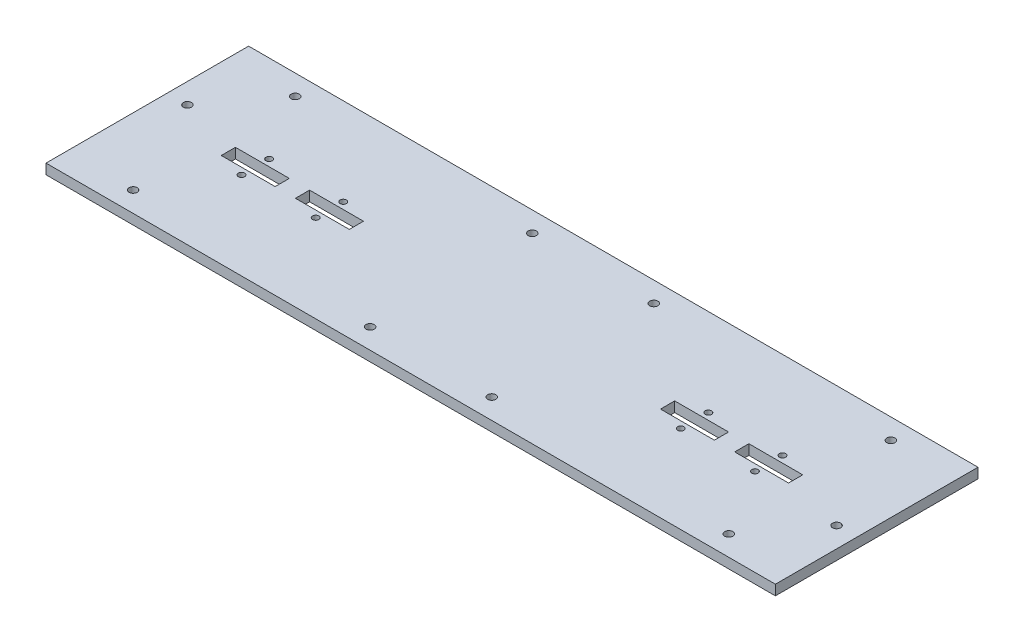
from build123d import *

# Parameters (mm, degrees)
SKETCH1_W           = 457.2
SKETCH1_H           = 127
SKETCH1_R           = 2.5527
BOSS_EXTRUDE1_DEPTH = 6.35
CUT_EXTRUDE1_REACH  = 476.554
SKETCH2_R           = 1.9812
SKETCH2_W           = 33.782
SKETCH2_H           = 8.89


with BuildPart() as part:
    # Sketch1 → Boss-Extrude1 (new body)
    with BuildSketch(Plane(origin=(0, 0, 0), x_dir=(1, 0, 0), z_dir=(0, 1, 0))):
        with Locations((228.6, 63.5)):
            Rectangle(SKETCH1_W, SKETCH1_H)
        with Locations(Location((41.91, 114.3, 0), (0, 0, 270))):
            Circle(SKETCH1_R, mode=Mode.SUBTRACT)
        with Locations(Location((415.29, 114.3, 0), (0, 0, 270))):
            Circle(SKETCH1_R, mode=Mode.SUBTRACT)
        with Locations(Location((415.29, 12.7, 0), (0, 0, 270))):
            Circle(SKETCH1_R, mode=Mode.SUBTRACT)
        with Locations(Location((41.91, 12.7, 0), (0, 0, 270))):
            Circle(SKETCH1_R, mode=Mode.SUBTRACT)
        with Locations(Location((190.5, 114.3, 0), (0, 0, 270))):
            Circle(SKETCH1_R, mode=Mode.SUBTRACT)
        with Locations(Location((266.7, 114.3, 0), (0, 0, 270))):
            Circle(SKETCH1_R, mode=Mode.SUBTRACT)
        with Locations(Location((190.5, 12.7, 0), (0, 0, 270))):
            Circle(SKETCH1_R, mode=Mode.SUBTRACT)
        with Locations(Location((266.7, 12.7, 0), (0, 0, 270))):
            Circle(SKETCH1_R, mode=Mode.SUBTRACT)
        with Locations(Location((444.5, 51.054, 0), (0, 0, 270))):
            Circle(SKETCH1_R, mode=Mode.SUBTRACT)
        with Locations(Location((12.7, 75.946, 0), (0, 0, 270))):
            Circle(SKETCH1_R, mode=Mode.SUBTRACT)
    extrude(amount=BOSS_EXTRUDE1_DEPTH)

    # Sketch2 → Cut-Extrude1 (cut, up to next)
    with BuildSketch(Plane(origin=(0, 0, 0), x_dir=(-1, 0, 0), z_dir=(0, -1, 0)), mode=Mode.PRIVATE) as cut_extrude1_sk1:
        with Locations(Location((-389.509, 54.864, 0), (0, 0, 90))):
            Circle(SKETCH2_R)
    cut_extrude1_tool1 = extrude(cut_extrude1_sk1.sketch, amount=-CUT_EXTRUDE1_REACH, mode=Mode.PRIVATE) & part.part
    # Sketch2 → Cut-Extrude1 (cut, up to next)
    with BuildSketch(Plane(origin=(0, 0, 0), x_dir=(-1, 0, 0), z_dir=(0, -1, 0)), mode=Mode.PRIVATE) as cut_extrude1_sk2:
        with Locations(Location((-389.509, 72.136, 0), (0, 0, 90))):
            Circle(SKETCH2_R)
    cut_extrude1_tool2 = extrude(cut_extrude1_sk2.sketch, amount=-CUT_EXTRUDE1_REACH, mode=Mode.PRIVATE) & part.part
    # Sketch2 → Cut-Extrude1 (cut, up to next)
    with BuildSketch(Plane(origin=(0, 0, 0), x_dir=(-1, 0, 0), z_dir=(0, -1, 0)), mode=Mode.PRIVATE) as cut_extrude1_sk3:
        with Locations(Location((-343.027, 54.864, 0), (0, 0, 90))):
            Circle(SKETCH2_R)
    cut_extrude1_tool3 = extrude(cut_extrude1_sk3.sketch, amount=-CUT_EXTRUDE1_REACH, mode=Mode.PRIVATE) & part.part
    # Sketch2 → Cut-Extrude1 (cut, up to next)
    with BuildSketch(Plane(origin=(0, 0, 0), x_dir=(-1, 0, 0), z_dir=(0, -1, 0)), mode=Mode.PRIVATE) as cut_extrude1_sk4:
        with Locations(Location((-343.027, 72.136, 0), (0, 0, 90))):
            Circle(SKETCH2_R)
    cut_extrude1_tool4 = extrude(cut_extrude1_sk4.sketch, amount=-CUT_EXTRUDE1_REACH, mode=Mode.PRIVATE) & part.part
    # Sketch2 → Cut-Extrude1 (cut, up to next)
    with BuildSketch(Plane(origin=(0, 0, 0), x_dir=(-1, 0, 0), z_dir=(0, -1, 0)), mode=Mode.PRIVATE) as cut_extrude1_sk5:
        with Locations(Location((-114.173, 54.864, 0), (0, 0, 90))):
            Circle(SKETCH2_R)
    cut_extrude1_tool5 = extrude(cut_extrude1_sk5.sketch, amount=-CUT_EXTRUDE1_REACH, mode=Mode.PRIVATE) & part.part
    # Sketch2 → Cut-Extrude1 (cut, up to next)
    with BuildSketch(Plane(origin=(0, 0, 0), x_dir=(-1, 0, 0), z_dir=(0, -1, 0)), mode=Mode.PRIVATE) as cut_extrude1_sk6:
        with Locations(Location((-114.173, 72.136, 0), (0, 0, 90))):
            Circle(SKETCH2_R)
    cut_extrude1_tool6 = extrude(cut_extrude1_sk6.sketch, amount=-CUT_EXTRUDE1_REACH, mode=Mode.PRIVATE) & part.part
    # Sketch2 → Cut-Extrude1 (cut, up to next)
    with BuildSketch(Plane(origin=(0, 0, 0), x_dir=(-1, 0, 0), z_dir=(0, -1, 0)), mode=Mode.PRIVATE) as cut_extrude1_sk7:
        with Locations(Location((-67.691, 54.864, 0), (0, 0, 90))):
            Circle(SKETCH2_R)
    cut_extrude1_tool7 = extrude(cut_extrude1_sk7.sketch, amount=-CUT_EXTRUDE1_REACH, mode=Mode.PRIVATE) & part.part
    # Sketch2 → Cut-Extrude1 (cut, up to next)
    with BuildSketch(Plane(origin=(0, 0, 0), x_dir=(-1, 0, 0), z_dir=(0, -1, 0)), mode=Mode.PRIVATE) as cut_extrude1_sk8:
        with Locations(Location((-67.691, 72.136, 0), (0, 0, 90))):
            Circle(SKETCH2_R)
    cut_extrude1_tool8 = extrude(cut_extrude1_sk8.sketch, amount=-CUT_EXTRUDE1_REACH, mode=Mode.PRIVATE) & part.part
    # Sketch2 → Cut-Extrude1 (cut, up to next)
    with BuildSketch(Plane(origin=(0, 0, 0), x_dir=(-1, 0, 0), z_dir=(0, -1, 0)), mode=Mode.PRIVATE) as cut_extrude1_sk9:
        with Locations((-114.173, 63.5)):
            Rectangle(SKETCH2_W, SKETCH2_H)
    cut_extrude1_tool9 = extrude(cut_extrude1_sk9.sketch, amount=-CUT_EXTRUDE1_REACH, mode=Mode.PRIVATE) & part.part
    # Sketch2 → Cut-Extrude1 (cut, up to next)
    with BuildSketch(Plane(origin=(0, 0, 0), x_dir=(-1, 0, 0), z_dir=(0, -1, 0)), mode=Mode.PRIVATE) as cut_extrude1_sk10:
        with Locations((-389.509, 63.5)):
            Rectangle(SKETCH2_W, SKETCH2_H)
    cut_extrude1_tool10 = extrude(cut_extrude1_sk10.sketch, amount=-CUT_EXTRUDE1_REACH, mode=Mode.PRIVATE) & part.part
    # Sketch2 → Cut-Extrude1 (cut, up to next)
    with BuildSketch(Plane(origin=(0, 0, 0), x_dir=(-1, 0, 0), z_dir=(0, -1, 0)), mode=Mode.PRIVATE) as cut_extrude1_sk11:
        with Locations((-343.027, 63.5)):
            Rectangle(SKETCH2_W, SKETCH2_H)
    cut_extrude1_tool11 = extrude(cut_extrude1_sk11.sketch, amount=-CUT_EXTRUDE1_REACH, mode=Mode.PRIVATE) & part.part
    # Sketch2 → Cut-Extrude1 (cut, up to next)
    with BuildSketch(Plane(origin=(0, 0, 0), x_dir=(-1, 0, 0), z_dir=(0, -1, 0)), mode=Mode.PRIVATE) as cut_extrude1_sk12:
        with Locations((-67.691, 63.5)):
            Rectangle(SKETCH2_W, SKETCH2_H)
    cut_extrude1_tool12 = extrude(cut_extrude1_sk12.sketch, amount=-CUT_EXTRUDE1_REACH, mode=Mode.PRIVATE) & part.part
    add(cut_extrude1_tool1.solids().sort_by_distance((389.509, 0, -54.864))[0], mode=Mode.SUBTRACT)
    add(cut_extrude1_tool2.solids().sort_by_distance((389.509, 0, -72.136))[0], mode=Mode.SUBTRACT)
    add(cut_extrude1_tool3.solids().sort_by_distance((343.027, 0, -54.864))[0], mode=Mode.SUBTRACT)
    add(cut_extrude1_tool4.solids().sort_by_distance((343.027, 0, -72.136))[0], mode=Mode.SUBTRACT)
    add(cut_extrude1_tool5.solids().sort_by_distance((114.173, 0, -54.864))[0], mode=Mode.SUBTRACT)
    add(cut_extrude1_tool6.solids().sort_by_distance((114.173, 0, -72.136))[0], mode=Mode.SUBTRACT)
    add(cut_extrude1_tool7.solids().sort_by_distance((67.691, 0, -54.864))[0], mode=Mode.SUBTRACT)
    add(cut_extrude1_tool8.solids().sort_by_distance((67.691, 0, -72.136))[0], mode=Mode.SUBTRACT)
    add(cut_extrude1_tool9.solids().sort_by_distance((114.173, 0, -63.5))[0], mode=Mode.SUBTRACT)
    add(cut_extrude1_tool10.solids().sort_by_distance((389.509, 0, -63.5))[0], mode=Mode.SUBTRACT)
    add(cut_extrude1_tool11.solids().sort_by_distance((343.027, 0, -63.5))[0], mode=Mode.SUBTRACT)
    add(cut_extrude1_tool12.solids().sort_by_distance((67.691, 0, -63.5))[0], mode=Mode.SUBTRACT)


solid = part.part
